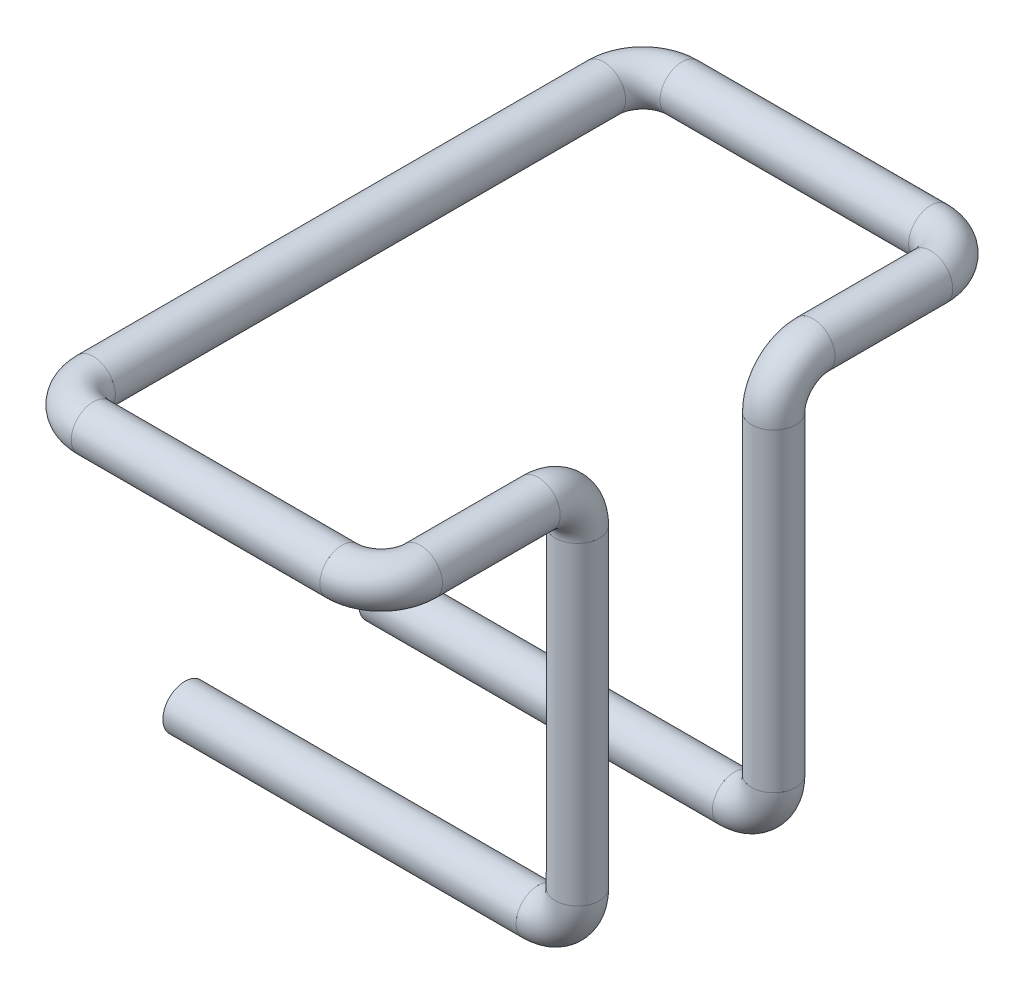
from build123d import *

# Parameters (mm, degrees)
SKETCH1_ON_SEGMENT_1_R     = 16.85
SKETCH1_ON_SEGMENT_1_R_2   = 12.85
PIPE_33_7_X_4_0_1_DEPTH    = 270
SKETCH1_ON_SEGMENT_2_R     = 16.85
SKETCH1_ON_SEGMENT_2_R_2   = 12.85
PIPE_33_7_X_4_0_1_2_ANGLE  = 90
SKETCH1_ON_SEGMENT_3_R     = 16.85
SKETCH1_ON_SEGMENT_3_R_2   = 12.85
PIPE_33_7_X_4_0_1_3_DEPTH  = 240
SKETCH1_ON_SEGMENT_4_R     = 16.85
SKETCH1_ON_SEGMENT_4_R_2   = 12.85
PIPE_33_7_X_4_0_1_4_ANGLE  = 90
SKETCH1_ON_SEGMENT_5_R     = 16.85
SKETCH1_ON_SEGMENT_5_R_2   = 12.85
PIPE_33_7_X_4_0_1_5_DEPTH  = 90
SKETCH1_ON_SEGMENT_6_R     = 16.85
SKETCH1_ON_SEGMENT_6_R_2   = 12.85
PIPE_33_7_X_4_0_1_6_ANGLE  = 90
SKETCH1_ON_SEGMENT_7_R     = 16.85
SKETCH1_ON_SEGMENT_7_R_2   = 12.85
PIPE_33_7_X_4_0_1_7_DEPTH  = 190
SKETCH1_ON_SEGMENT_8_R     = 16.85
SKETCH1_ON_SEGMENT_8_R_2   = 12.85
PIPE_33_7_X_4_0_1_8_ANGLE  = 90
SKETCH1_ON_SEGMENT_9_R     = 16.85
SKETCH1_ON_SEGMENT_9_R_2   = 12.85
PIPE_33_7_X_4_0_1_9_DEPTH  = 390
SKETCH1_ON_SEGMENT_10_R    = 16.85
SKETCH1_ON_SEGMENT_10_R_2  = 12.85
PIPE_33_7_X_4_0_1_10_ANGLE = 90
SKETCH1_ON_SEGMENT_11_R    = 16.85
SKETCH1_ON_SEGMENT_11_R_2  = 12.85
PIPE_33_7_X_4_0_1_11_DEPTH = 190
SKETCH1_ON_SEGMENT_12_R    = 16.85
SKETCH1_ON_SEGMENT_12_R_2  = 12.85
PIPE_33_7_X_4_0_1_12_ANGLE = 90
SKETCH1_ON_SEGMENT_13_R    = 16.85
SKETCH1_ON_SEGMENT_13_R_2  = 12.85
PIPE_33_7_X_4_0_1_13_DEPTH = 90
SKETCH1_ON_SEGMENT_14_R    = 16.85
SKETCH1_ON_SEGMENT_14_R_2  = 12.85
PIPE_33_7_X_4_0_1_14_ANGLE = 90
SKETCH1_ON_SEGMENT_15_R    = 16.85
SKETCH1_ON_SEGMENT_15_R_2  = 12.85
PIPE_33_7_X_4_0_1_15_DEPTH = 240
SKETCH1_ON_SEGMENT_16_R    = 16.85
SKETCH1_ON_SEGMENT_16_R_2  = 12.85
PIPE_33_7_X_4_0_1_16_ANGLE = 90
SKETCH1_R                  = 16.85
SKETCH1_R_2                = 12.85
PIPE_33_7_X_4_0_1_17_DEPTH = 270


with BuildPart() as part:
    # Sketch1 on segment 1 (carried to segment 1) → Pipe 33.7 X 4.0(1) (new body)
    with BuildSketch(Plane.ZY.offset(-270)):
        Circle(SKETCH1_ON_SEGMENT_1_R)
        Circle(SKETCH1_ON_SEGMENT_1_R_2, mode=Mode.SUBTRACT)
    extrude(amount=PIPE_33_7_X_4_0_1_DEPTH)


with BuildPart() as body_2:
    # Sketch1 on segment 2 (carried to the start of arc 2) → Pipe 33.7 X 4.0_1 2 (revolve)
    with BuildSketch(Plane(origin=(300, 30, 0), x_dir=(0, 0, 1), z_dir=(0, -1, 0))):
        Circle(SKETCH1_ON_SEGMENT_2_R)
        Circle(SKETCH1_ON_SEGMENT_2_R_2, mode=Mode.SUBTRACT)
    revolve(axis=Axis((270, 30, 0), (0, 0, -1)), revolution_arc=PIPE_33_7_X_4_0_1_2_ANGLE)


with BuildPart() as body_3:
    # Sketch1 on segment 3 (carried to segment 3) → Pipe 33.7 X 4.0_1 3 (new body)
    with BuildSketch(Plane(origin=(300, 30, 0), x_dir=(0, 0, 1), z_dir=(0, 1, 0))):
        Circle(SKETCH1_ON_SEGMENT_3_R)
        Circle(SKETCH1_ON_SEGMENT_3_R_2, mode=Mode.SUBTRACT)
    extrude(amount=PIPE_33_7_X_4_0_1_3_DEPTH)


with BuildPart() as body_4:
    # Sketch1 on segment 4 (carried to the start of arc 4) → Pipe 33.7 X 4.0_1 4 (revolve)
    with BuildSketch(Plane(origin=(300, 270, 0), x_dir=(0, 0, 1), z_dir=(0, 1, 0))):
        Circle(SKETCH1_ON_SEGMENT_4_R)
        Circle(SKETCH1_ON_SEGMENT_4_R_2, mode=Mode.SUBTRACT)
    revolve(axis=Axis((300, 270, -30), (-1, 0, 0)), revolution_arc=PIPE_33_7_X_4_0_1_4_ANGLE)


with BuildPart() as body_5:
    # Sketch1 on segment 5 (carried to segment 5) → Pipe 33.7 X 4.0_1 5 (new body)
    with BuildSketch(Plane(origin=(300, 300, -30), x_dir=(-1, 0, 0), z_dir=(0, 0, -1))):
        Circle(SKETCH1_ON_SEGMENT_5_R)
        Circle(SKETCH1_ON_SEGMENT_5_R_2, mode=Mode.SUBTRACT)
    extrude(amount=PIPE_33_7_X_4_0_1_5_DEPTH)


with BuildPart() as body_6:
    # Sketch1 on segment 6 (carried to the start of arc 6) → Pipe 33.7 X 4.0_1 6 (revolve)
    with BuildSketch(Plane(origin=(270, 300, -150), x_dir=(0, 0, -1), z_dir=(1, 0, 0))):
        Circle(SKETCH1_ON_SEGMENT_6_R)
        Circle(SKETCH1_ON_SEGMENT_6_R_2, mode=Mode.SUBTRACT)
    revolve(axis=Axis((270, 300, -120), (0, -1, 0)), revolution_arc=PIPE_33_7_X_4_0_1_6_ANGLE)


with BuildPart() as body_7:
    # Sketch1 on segment 7 (carried to segment 7) → Pipe 33.7 X 4.0_1 7 (new body)
    with BuildSketch(Plane(origin=(270, 300, -150), x_dir=(0, 0, 1), z_dir=(-1, 0, 0))):
        Circle(SKETCH1_ON_SEGMENT_7_R)
        Circle(SKETCH1_ON_SEGMENT_7_R_2, mode=Mode.SUBTRACT)
    extrude(amount=PIPE_33_7_X_4_0_1_7_DEPTH)


with BuildPart() as body_8:
    # Sketch1 on segment 8 (carried to the start of arc 8) → Pipe 33.7 X 4.0_1 8 (revolve)
    with BuildSketch(Plane(origin=(80, 300, -150), x_dir=(0, 0, 1), z_dir=(-1, 0, 0))):
        Circle(SKETCH1_ON_SEGMENT_8_R)
        Circle(SKETCH1_ON_SEGMENT_8_R_2, mode=Mode.SUBTRACT)
    revolve(axis=Axis((80, 300, -120), (0, 1, 0)), revolution_arc=PIPE_33_7_X_4_0_1_8_ANGLE)


with BuildPart() as body_9:
    # Sketch1 on segment 9 (carried to segment 9) → Pipe 33.7 X 4.0_1 9 (new body)
    with BuildSketch(Plane(origin=(50, 300, -120), x_dir=(1, 0, 0), z_dir=(0, 0, 1))):
        Circle(SKETCH1_ON_SEGMENT_9_R)
        Circle(SKETCH1_ON_SEGMENT_9_R_2, mode=Mode.SUBTRACT)
    extrude(amount=PIPE_33_7_X_4_0_1_9_DEPTH)


with BuildPart() as body_10:
    # Sketch1 on segment 10 (carried to the start of arc 10) → Pipe 33.7 X 4.0_1 10 (revolve)
    with BuildSketch(Plane(origin=(80, 300, 300), x_dir=(0, 0, 1), z_dir=(-1, 0, 0))):
        Circle(SKETCH1_ON_SEGMENT_10_R)
        Circle(SKETCH1_ON_SEGMENT_10_R_2, mode=Mode.SUBTRACT)
    revolve(axis=Axis((80, 300, 270), (0, -1, 0)), revolution_arc=PIPE_33_7_X_4_0_1_10_ANGLE)


with BuildPart() as body_11:
    # Sketch1 on segment 11 (carried to segment 11) → Pipe 33.7 X 4.0_1 11 (new body)
    with BuildSketch(Plane(origin=(270, 300, 300), x_dir=(0, 0, 1), z_dir=(-1, 0, 0))):
        Circle(SKETCH1_ON_SEGMENT_11_R)
        Circle(SKETCH1_ON_SEGMENT_11_R_2, mode=Mode.SUBTRACT)
    extrude(amount=PIPE_33_7_X_4_0_1_11_DEPTH)


with BuildPart() as body_12:
    # Sketch1 on segment 12 (carried to the start of arc 12) → Pipe 33.7 X 4.0_1 12 (revolve)
    with BuildSketch(Plane(origin=(300, 300, 270), x_dir=(1, 0, 0), z_dir=(0, 0, 1))):
        Circle(SKETCH1_ON_SEGMENT_12_R)
        Circle(SKETCH1_ON_SEGMENT_12_R_2, mode=Mode.SUBTRACT)
    revolve(axis=Axis((270, 300, 270), (0, -1, 0)), revolution_arc=PIPE_33_7_X_4_0_1_12_ANGLE)


with BuildPart() as body_13:
    # Sketch1 on segment 13 (carried to segment 13) → Pipe 33.7 X 4.0_1 13 (new body)
    with BuildSketch(Plane(origin=(300, 300, 270), x_dir=(-1, 0, 0), z_dir=(0, 0, -1))):
        Circle(SKETCH1_ON_SEGMENT_13_R)
        Circle(SKETCH1_ON_SEGMENT_13_R_2, mode=Mode.SUBTRACT)
    extrude(amount=PIPE_33_7_X_4_0_1_13_DEPTH)


with BuildPart() as body_14:
    # Sketch1 on segment 14 (carried to the start of arc 14) → Pipe 33.7 X 4.0_1 14 (revolve)
    with BuildSketch(Plane(origin=(300, 270, 150), x_dir=(0, 0, 1), z_dir=(0, 1, 0))):
        Circle(SKETCH1_ON_SEGMENT_14_R)
        Circle(SKETCH1_ON_SEGMENT_14_R_2, mode=Mode.SUBTRACT)
    revolve(axis=Axis((300, 270, 180), (1, 0, 0)), revolution_arc=PIPE_33_7_X_4_0_1_14_ANGLE)


with BuildPart() as body_15:
    # Sketch1 on segment 15 (carried to segment 15) → Pipe 33.7 X 4.0_1 15 (new body)
    with BuildSketch(Plane(origin=(300, 270, 150), x_dir=(0, 0, 1), z_dir=(0, -1, 0))):
        Circle(SKETCH1_ON_SEGMENT_15_R)
        Circle(SKETCH1_ON_SEGMENT_15_R_2, mode=Mode.SUBTRACT)
    extrude(amount=PIPE_33_7_X_4_0_1_15_DEPTH)


with BuildPart() as body_16:
    # Sketch1 on segment 16 (carried to the start of arc 16) → Pipe 33.7 X 4.0_1 16 (revolve)
    with BuildSketch(Plane(origin=(300, 30, 150), x_dir=(0, 0, 1), z_dir=(0, -1, 0))):
        Circle(SKETCH1_ON_SEGMENT_16_R)
        Circle(SKETCH1_ON_SEGMENT_16_R_2, mode=Mode.SUBTRACT)
    revolve(axis=Axis((270, 30, 150), (0, 0, -1)), revolution_arc=PIPE_33_7_X_4_0_1_16_ANGLE)


with BuildPart() as body_17:
    # Sketch1 → Pipe 33.7 X 4.0_1 17 (new body)
    with BuildSketch(Plane(origin=(270, 0, 150), x_dir=(0, 0, 1), z_dir=(-1, 0, 0))):
        Circle(SKETCH1_R)
        Circle(SKETCH1_R_2, mode=Mode.SUBTRACT)
    extrude(amount=PIPE_33_7_X_4_0_1_17_DEPTH)


solid = Compound([part.part, body_2.part, body_3.part, body_4.part, body_5.part, body_6.part, body_7.part, body_8.part, body_9.part, body_10.part, body_11.part, body_12.part, body_13.part, body_14.part, body_15.part, body_16.part, body_17.part])
